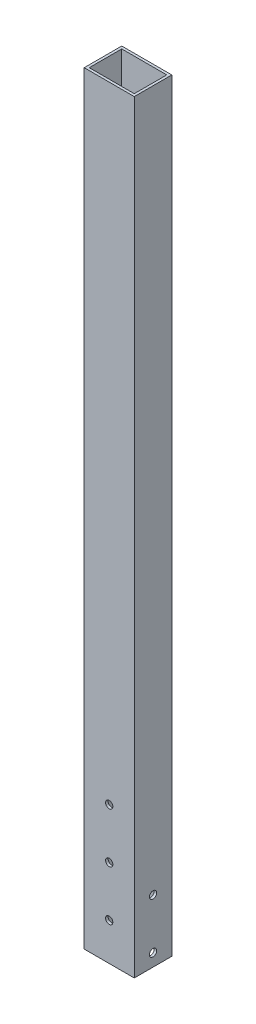
from build123d import *

# Parameters (mm, degrees)
SKETCH_1_W          = 20
SKETCH_1_H          = 15
SKETCH_1_W_2        = 18
SKETCH_1_H_2        = 13
EXTRUDE_1_DEPTH     = 305
SKETCH_2_R          = 1.45
CUT_EXTRUDE_1_DEPTH = 306.747035963
SKETCH_3_R          = 1.45
CUT_EXTRUDE_2_DEPTH = 306.532322349


with BuildPart() as part:
    # 草图1 → 拉伸-薄壁1 (new body)
    with BuildSketch(Plane(origin=(0, 0, 0), x_dir=(1, 0, 0), z_dir=(0, 1, 0))):
        Rectangle(SKETCH_1_W, SKETCH_1_H)
        Rectangle(SKETCH_1_W_2, SKETCH_1_H_2, mode=Mode.SUBTRACT)
    extrude(amount=EXTRUDE_1_DEPTH)

    # 草图2 → 切除-拉伸1 (cut, through all)
    with BuildSketch(Plane(origin=(10, 0, 0), x_dir=(0, 0, -1), z_dir=(1, 0, 0))):
        with Locations((0, 5)):
            Circle(SKETCH_2_R)
        with Locations((0, 25)):
            Circle(SKETCH_2_R)
    extrude(amount=-CUT_EXTRUDE_1_DEPTH, mode=Mode.SUBTRACT)

    # 草图3 → 切除-拉伸2 (cut, through all)
    with BuildSketch(Plane(origin=(0, 0, -7.5), x_dir=(-1, 0, 0), z_dir=(0, 0, -1))):
        with Locations((0, 15)):
            Circle(SKETCH_3_R)
        with Locations((0, 35)):
            Circle(SKETCH_3_R)
        with Locations((0, 55)):
            Circle(SKETCH_3_R)
    extrude(amount=-CUT_EXTRUDE_2_DEPTH, mode=Mode.SUBTRACT)


solid = part.part
